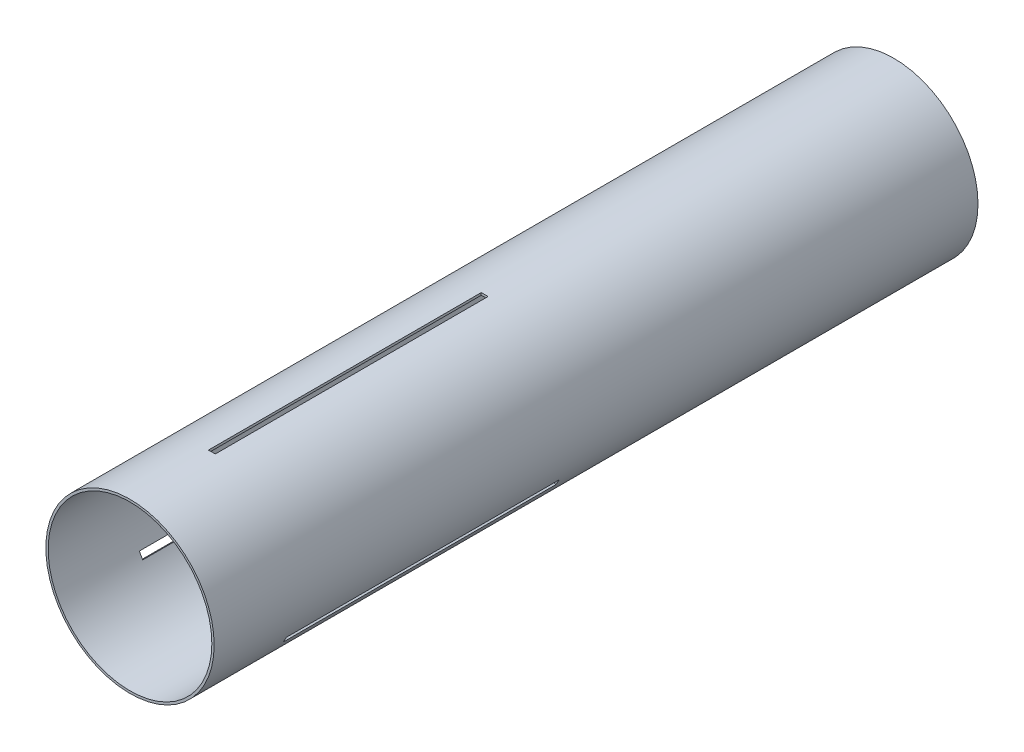
from build123d import *

# Parameters (mm, degrees)
ESQUISSE2_R                  = 78.359
ESQUISSE2_R_2                = 76.2
BOSS_EXTRU_1_DEPTH           = 711.2
ESQUISSE3_W                  = 6.35
ESQUISSE3_H                  = 254
ENL_V_MAT_EXTRU_1_DEPTH      = 153.416
R_P_TITION_CIRCULAIRE1_COUNT = 3


with BuildPart() as part:
    # Esquisse2 → Boss.-Extru.1 (new body)
    with BuildSketch(Plane.XY):
        Circle(ESQUISSE2_R)
        Circle(ESQUISSE2_R_2, mode=Mode.SUBTRACT)
    extrude(amount=BOSS_EXTRU_1_DEPTH)

    # Esquisse3 → Enlèv. mat.-Extru.1 (cut)
    with BuildSketch(Plane(origin=(0, 0, 0), x_dir=(1, 0, 0), z_dir=(0, 1, 0))):
        with Locations((0, -508)):
            Rectangle(ESQUISSE3_W, ESQUISSE3_H)
    enl_v_mat_extru_1 = extrude(amount=ENL_V_MAT_EXTRU_1_DEPTH, mode=Mode.SUBTRACT)

    # Répétition circulaire1: Enlèv. mat.-Extru.1 ×3 about axis
    r_p_tition_circulaire1_axis = Axis((0, 0, 0), (0, 0, 1))
    for i in range(1, R_P_TITION_CIRCULAIRE1_COUNT):
        add(enl_v_mat_extru_1.rotate(r_p_tition_circulaire1_axis, i * 360 / R_P_TITION_CIRCULAIRE1_COUNT), mode=Mode.SUBTRACT)


solid = part.part
